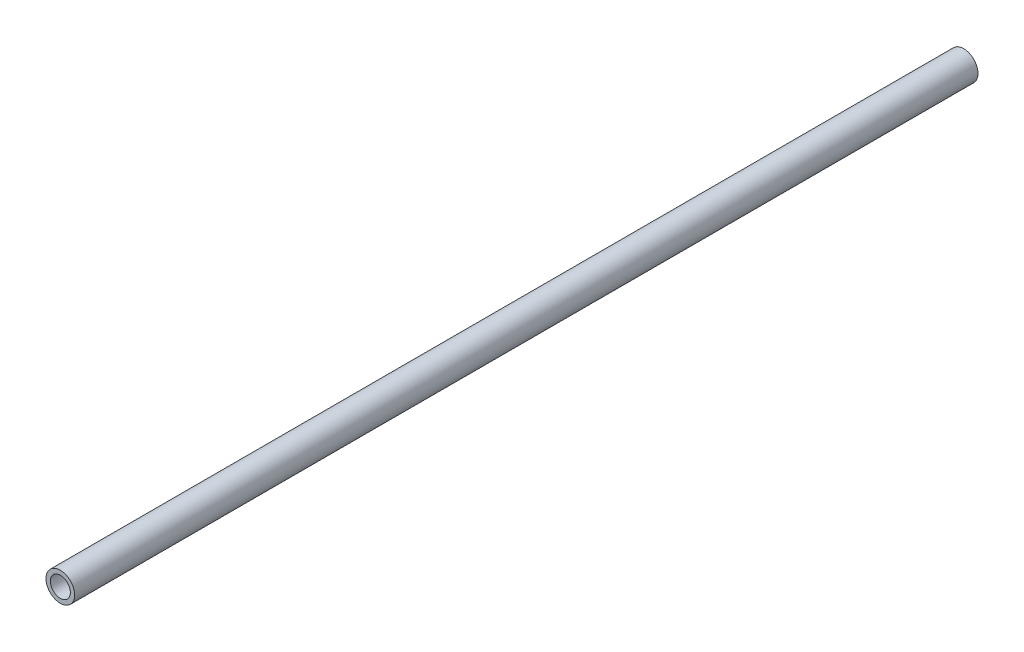
from build123d import *

# Parameters (mm, degrees)
SKETCH1_R           = 15.875
SKETCH1_R_2         = 11.1
BOSS_EXTRUDE1_DEPTH = 1000


with BuildPart() as part:
    # Sketch1 → Boss-Extrude1 (new body)
    with BuildSketch(Plane(origin=(0, 0, 0), x_dir=(0, 1, 0), z_dir=(0, 0, 1))):
        with Locations(Location((0, 0, 0), (0, 0, 270))):
            Circle(SKETCH1_R)
        with Locations(Location((0, 0, 0), (0, 0, 270))):
            Circle(SKETCH1_R_2, mode=Mode.SUBTRACT)
    extrude(amount=BOSS_EXTRUDE1_DEPTH)


solid = part.part
